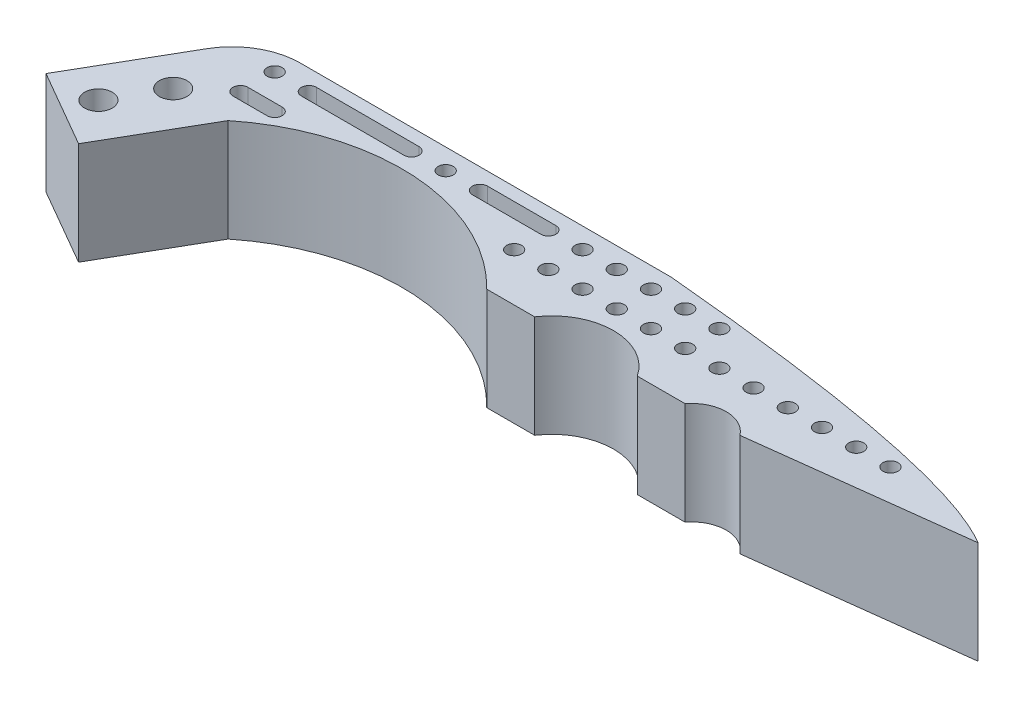
from build123d import *

# Parameters (mm, degrees)
EXTRUDE_1_DEPTH     = 15
SKETCH_2_R          = 1.1
SKETCH_2_R_2        = 2.02
CUT_EXTRUDE_1_DEPTH = 15
CUT_EXTRUDE_2_REACH = 125.786
FILLET_1_R          = 10


with BuildPart() as part:
    # 草图1 → 凸台-拉伸1 (new body)
    with BuildSketch(Plane(origin=(0, 0, 0), x_dir=(1, 0, 0), z_dir=(0, 1, 0))):
        with BuildLine():
            Line((0, 0), (60, 0))
            add(Edge.make_bspline(
                [(60, 0), (115, -5), (120, -15)],
                knots=[0, 0, 0, 1, 1, 1], degree=2))
            Line((120, -15), (85, -15))
            ThreePointArc((85, -15), (81, -13), (77, -15))
            Line((77, -15), (70, -15))
            ThreePointArc((70, -15), (62.5, -10.974937186), (55, -15))
            Line((55, -15), (48, -15))
            ThreePointArc((48, -15), (28.349696115, -6.013929798), (7.758330249, -12.562177826))
            Line((7.758330249, -12.562177826), (-0.241669751, -26.418584287))
            Line((-0.241669751, -26.418584287), (-11.5, -19.918584287))
            Line((-11.5, -19.918584287), (0, 0))
        make_face()
    extrude(amount=EXTRUDE_1_DEPTH)

    # 草图2 → 切除-拉伸1 (cut)
    with BuildSketch(Plane(origin=(0, 15, 0), x_dir=(1, 0, 0), z_dir=(0, 1, 0))):
        with Locations(Location((5, -3, 0), (0, 0, 270))):
            Circle(SKETCH_2_R)
        with Locations(Location((30, -3, 0), (0, 0, 270))):
            Circle(SKETCH_2_R)
        with Locations(Location((55, -3, 0), (0, 0, 270))):
            Circle(SKETCH_2_R)
        with Locations(Location((60, -3, 0), (0, 0, 270))):
            Circle(SKETCH_2_R)
        with Locations(Location((45, -8, 0), (0, 0, 270))):
            Circle(SKETCH_2_R)
        with Locations(Location((50, -8, 0), (0, 0, 270))):
            Circle(SKETCH_2_R)
        with Locations(Location((55, -8, 0), (0, 0, 270))):
            Circle(SKETCH_2_R)
        with Locations(Location((60, -8, 0), (0, 0, 270))):
            Circle(SKETCH_2_R)
        with Locations(Location((65, -3, 0), (0, 0, 270))):
            Circle(SKETCH_2_R)
        with Locations(Location((65, -8, 0), (0, 0, 270))):
            Circle(SKETCH_2_R)
        with Locations(Location((70, -8, 0), (0, 0, 270))):
            Circle(SKETCH_2_R)
        with Locations(Location((75, -8, 0), (0, 0, 270))):
            Circle(SKETCH_2_R)
        with Locations(Location((70, -3, 0), (0, 0, 270))):
            Circle(SKETCH_2_R)
        with Locations(Location((-4.303847577, -19.454482672, 0), (0, 0, 270))):
            Circle(SKETCH_2_R_2)
        with Locations(Location((50, -3, 0), (0, 0, 270))):
            Circle(SKETCH_2_R)
        with Locations(Location((-0.303847577, -12.526279442, 0), (0, 0, 270))):
            Circle(SKETCH_2_R_2)
        with Locations(Location((80, -8, 0), (0, 0, 270))):
            Circle(SKETCH_2_R)
        with Locations(Location((85, -8, 0), (0, 0, 270))):
            Circle(SKETCH_2_R)
        with Locations(Location((90, -8, 0), (0, 0, 270))):
            Circle(SKETCH_2_R)
        with Locations(Location((95, -8, 0), (0, 0, 270))):
            Circle(SKETCH_2_R)
        with Locations(Location((100, -8, 0), (0, 0, 270))):
            Circle(SKETCH_2_R)
        with BuildLine():
            Line((10, -4.1), (25, -4.1))
            ThreePointArc((25, -4.1), (26.1, -3), (25, -1.9))
            Line((25, -1.9), (10, -1.9))
            ThreePointArc((10, -1.9), (8.9, -3), (10, -4.1))
        make_face()
        with BuildLine():
            Line((35, -1.9), (45, -1.9))
            ThreePointArc((45, -1.9), (46.1, -3), (45, -4.1))
            Line((45, -4.1), (35, -4.1))
            ThreePointArc((35, -4.1), (33.9, -3), (35, -1.9))
        make_face()
        with BuildLine():
            Line((5, -6.9), (10, -6.9))
            ThreePointArc((10, -6.9), (11.1, -8), (10, -9.1))
            Line((10, -9.1), (5, -9.1))
            ThreePointArc((5, -9.1), (3.9, -8), (5, -6.9))
        make_face()
    extrude(amount=-CUT_EXTRUDE_1_DEPTH, mode=Mode.SUBTRACT)

    # 草图4 → 切除-拉伸2 (cut, up to next)
    with BuildSketch(Plane(origin=(0, 15, 0), x_dir=(1, 0, 0), z_dir=(0, 1, 0)), mode=Mode.PRIVATE) as cut_extrude_2_sk1:
        Polygon((85, -15), (115.991250003, -11.194752977), (120, -11.194752977), (120, -15), align=None)
    cut_extrude_2_tool1 = extrude(cut_extrude_2_sk1.sketch, amount=-CUT_EXTRUDE_2_REACH, mode=Mode.PRIVATE) & part.part
    add(cut_extrude_2_tool1.solids().sort_by_distance((108.196013, 15, 13.601235))[0], mode=Mode.SUBTRACT)

    # 圆角1
    fillet_1_edges = [part.edges().sort_by_distance(p)[0] for p in [
        (0, 7.5, 0),
    ]]
    fillet(fillet_1_edges, radius=FILLET_1_R)


solid = part.part
